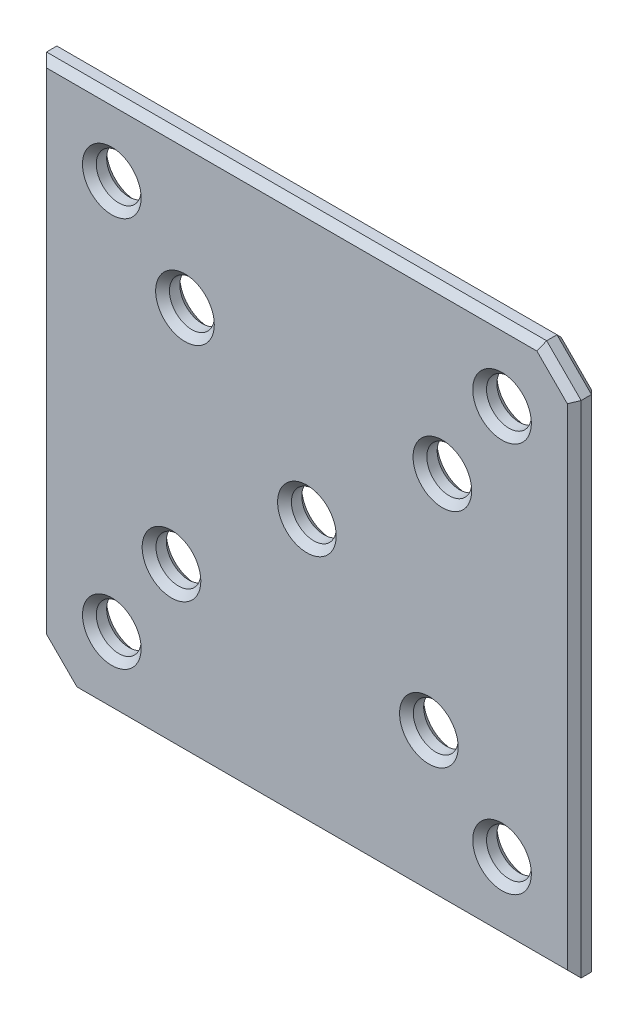
from build123d import *

# Parameters (mm, degrees)
SKETCH_1_R         = 13
EXTRUDE_1180_DEPTH = 14
CHAMFER_1_SIZE     = 4


with BuildPart() as part:
    # 草图1 → Extrude 1180 (new body)
    with BuildSketch(Plane.XY):
        Polygon((135, 155), (155, 135), (155, -155), (-135, -155), (-155, -135), (-155, 155), align=None)
        with Locations((-113.13708499, -113.13708499)):
            Circle(SKETCH_1_R, mode=Mode.SUBTRACT)
        with Locations((-78.524110604, -61.919012055)):
            Circle(SKETCH_1_R, mode=Mode.SUBTRACT)
        with Locations((78.524110604, 61.919012055)):
            Circle(SKETCH_1_R, mode=Mode.SUBTRACT)
        with Locations((113.13708499, 113.13708499)):
            Circle(SKETCH_1_R, mode=Mode.SUBTRACT)
        with Locations((-70.710678119, 70.710678119)):
            Circle(SKETCH_1_R, mode=Mode.SUBTRACT)
        with Locations((-113.13708499, 113.13708499)):
            Circle(SKETCH_1_R, mode=Mode.SUBTRACT)
        with Locations(Location((70.710678119, -70.710678119, 0), (0, 0, 180))):
            Circle(SKETCH_1_R, mode=Mode.SUBTRACT)
        with Locations(Location((113.13708499, -113.13708499, 0), (0, 0, 180))):
            Circle(SKETCH_1_R, mode=Mode.SUBTRACT)
        Circle(SKETCH_1_R, mode=Mode.SUBTRACT)
    extrude(amount=EXTRUDE_1180_DEPTH)

    # 倒角1
    chamfer_1_edges = [part.edges().sort_by_distance(p)[0] for p in [
        (10, -155, 14),
        (155, -10, 14),
        (145, 145, 14),
        (-126.13708499, -113.13708499, 0),
        (-126.13708499, -113.13708499, 14),
        (-10, 155, 14),
        (-91.524110604, -61.919012055, 0),
        (-91.524110604, -61.919012055, 14),
        (65.524110604, 61.919012055, 0),
        (65.524110604, 61.919012055, 14),
        (100.13708499, 113.13708499, 0),
        (100.13708499, 113.13708499, 14),
        (-83.710678119, 70.710678119, 0),
        (-83.710678119, 70.710678119, 14),
        (-126.13708499, 113.13708499, 0),
        (-126.13708499, 113.13708499, 14),
        (83.710678119, -70.710678119, 0),
        (83.710678119, -70.710678119, 14),
        (-155, 10, 14),
        (-13, 0, 0),
        (-13, 0, 14),
        (126.13708499, -113.13708499, 0),
        (126.13708499, -113.13708499, 14),
        (-10, 155, 0),
        (145, 145, 0),
        (155, -10, 0),
        (-145, -145, 14),
        (10, -155, 0),
        (-145, -145, 0),
        (-155, 10, 0),
    ]]
    chamfer(chamfer_1_edges, length=CHAMFER_1_SIZE)


solid = part.part
